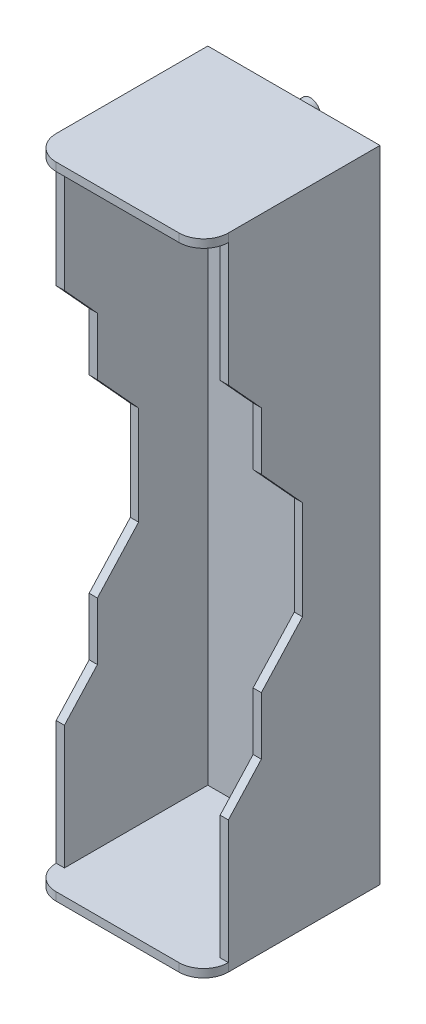
from build123d import *

# Parameters (mm, degrees)
SKETCH1_W           = 20.9
SKETCH1_H           = 21.4
BOSS_EXTRUDE1_DEPTH = 38.85
SKETCH2_W           = 18.9
SKETCH2_H           = 75.7
CUT_EXTRUDE1_DEPTH  = 20.4
CUT_EXTRUDE4_DEPTH  = 50.031545968
SKETCH4_R           = 1.2
BOSS_EXTRUDE2_DEPTH = 2
SKETCH5_R           = 1.6
CUT_EXTRUDE5_DEPTH  = 46.568464973
FILLET1_R           = 3


with BuildPart() as part:
    # Sketch1 → Boss-Extrude1 (new, symmetric)
    with BuildSketch(Plane(origin=(0, 0, 0), x_dir=(1, 0, 0), z_dir=(0, 1, 0))):
        with Locations((0, 10.7)):
            Rectangle(SKETCH1_W, SKETCH1_H)
    extrude(amount=BOSS_EXTRUDE1_DEPTH, both=True)

    # Sketch2 → Cut-Extrude1 (cut)
    with BuildSketch(Plane(origin=(0, 0, 0), x_dir=(-1, 0, 0), z_dir=(0, 0, -1))):
        Rectangle(SKETCH2_W, SKETCH2_H)
    extrude(amount=CUT_EXTRUDE1_DEPTH, mode=Mode.SUBTRACT)

    # Sketch3 → Cut-Extrude4 (cut, through all)
    with BuildSketch(Plane(origin=(10.45, 0, 0), x_dir=(0, 0, -1), z_dir=(1, 0, 0))):
        Polygon((0, 37.85), (3, 37.85), (3, 22.85), (7, 18.472222222), (7, 11.472222222), (12, 6), (12, -6), (7, -11.472222222), (7, -18.472222222), (3, -22.85), (3, -37.85), (0, -37.85), align=None)
    extrude(amount=-CUT_EXTRUDE4_DEPTH, mode=Mode.SUBTRACT)

    # Sketch4 → Boss-Extrude2 (add)
    with BuildSketch(Plane(origin=(0, 0, -21.4), x_dir=(-1, 0, 0), z_dir=(0, 0, -1))):
        with Locations(Location((0, -36.45, 0), (0, 0, 180))):
            Circle(SKETCH4_R)
        with Locations(Location((0, 36.45, 0), (0, 0, 180))):
            Circle(SKETCH4_R)
    extrude(amount=BOSS_EXTRUDE2_DEPTH)

    # Sketch5 → Cut-Extrude5 (cut, through all)
    with BuildSketch(Plane(origin=(0, 0, -21.4), x_dir=(-1, 0, 0), z_dir=(0, 0, -1))):
        with Locations((0, -27.805)):
            Circle(SKETCH5_R)
        with Locations(Location((0, 27.805, 0), (0, 0, 180))):
            Circle(SKETCH5_R)
    extrude(amount=-CUT_EXTRUDE5_DEPTH, mode=Mode.SUBTRACT)

    # Fillet1
    fillet1_edges = [part.edges().sort_by_distance(p)[0] for p in [
        (-10.45, 38.35, 0),
        (10.45, 38.35, 0),
        (-10.45, -38.35, 0),
        (10.45, -38.35, 0),
    ]]
    fillet(fillet1_edges, radius=FILLET1_R)


solid = part.part
